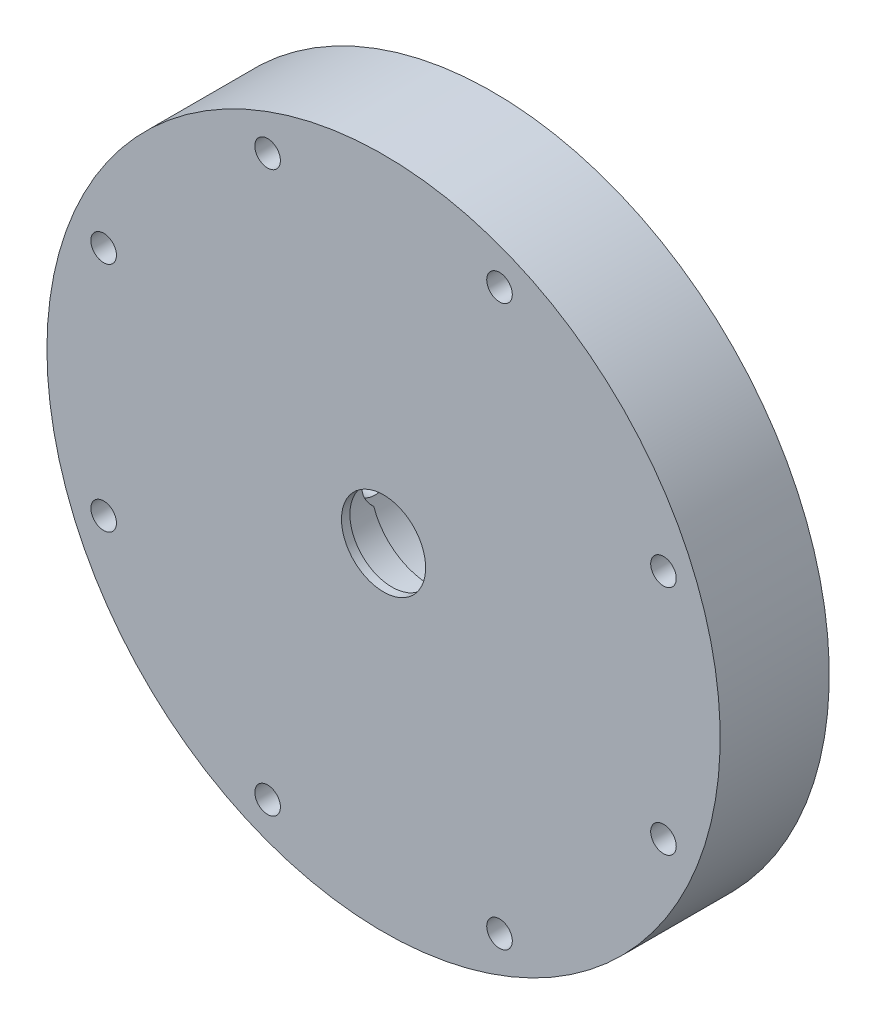
from build123d import *

# Parameters (mm, degrees)
SKETCH4_R                         = 2.413
CUT_EXTRUDE1_DEPTH                = 94.3255592
CIRPATTERN1_COUNT                 = 8
CUT_EXTRUDE7_START                = -4.826
SKETCH18_R                        = 63.5
SKETCH18_R_2                      = 2.413
CUT_EXTRUDE7_DEPTH                = 4.826
SKETCH17_R                        = 33.02
CUT_EXTRUDE6_DEPTH                = 7.112
PIPE_TAP_DRILL_FOR_3_8_TAP1_D     = 14.2748
PIPE_TAP_DRILL_FOR_3_8_TAP1_DEPTH = 12.7
PIPE_TAP_DRILL_FOR_3_8_TAP1_TIP   = 4.288582582
F_3_8_0_375_DIAMETER_HOLE1_D      = 9.525
F_3_8_0_375_DIAMETER_HOLE1_DEPTH  = 63.5
F_3_8_0_375_DIAMETER_HOLE1_TIP    = 2.861598698
SKETCH19_R                        = 50.8
SKETCH19_R_2                      = 46.0248
SEAL_GROOVE_DEPTH                 = 3.1369


with BuildPart() as part:
    # Sketch16 → Revolve1 (revolve)
    with BuildSketch(Plane(origin=(0, 0, 0), x_dir=(1, 0, 0), z_dir=(0, 1, 0)), mode=Mode.PRIVATE) as revolve1_sk:
        Polygon((7.9375, -25.4), (63.5, -25.4), (63.5, 0), (14.2875, 0), (14.2875, -16.66875), (11.176, -16.66875), (11.176, -23.8125), (7.9375, -23.8125), align=None)
    revolve(revolve1_sk.sketch.rotate(Axis((0, 0, 0), (0, 0, 1)), 180), axis=Axis((0, 0, 0), (0, 0, 1)))

    # Sketch4 → Cut-Extrude1 (cut, through all)
    with BuildSketch(Plane.XY.offset(25.4)):
        with Locations((52.799715283, -21.87035816)):
            Circle(SKETCH4_R)
    cut_extrude1 = extrude(amount=-CUT_EXTRUDE1_DEPTH, mode=Mode.SUBTRACT)

    # CirPattern1: Cut-Extrude1 ×8 about axis
    cirpattern1_axis = Axis((0, 0, 0), (0, 0, 1))
    for i in range(1, CIRPATTERN1_COUNT):
        add(cut_extrude1.rotate(cirpattern1_axis, i * 360 / CIRPATTERN1_COUNT), mode=Mode.SUBTRACT)

    # Sketch18 → Cut-Extrude7 (cut)
    with BuildSketch(Plane(origin=(0, 0, 0), x_dir=(-1, 0, 0), z_dir=(0, 0, -1)).offset(CUT_EXTRUDE7_START)):
        Circle(SKETCH18_R)
        with Locations(Location((-21.87035816, -52.799715283, 0), (0, 0, 225))):
            Circle(SKETCH18_R_2, mode=Mode.SUBTRACT)
        with Locations(Location((-52.799715283, -21.87035816, 0), (0, 0, 180))):
            Circle(SKETCH18_R_2, mode=Mode.SUBTRACT)
        with Locations(Location((21.87035816, -52.799715283, 0), (0, 0, 270))):
            Circle(SKETCH18_R_2, mode=Mode.SUBTRACT)
        with Locations(Location((52.799715283, -21.87035816, 0), (0, 0, 315))):
            Circle(SKETCH18_R_2, mode=Mode.SUBTRACT)
        with Locations((-52.799715283, 21.87035816)):
            Circle(SKETCH18_R_2, mode=Mode.SUBTRACT)
        with BuildLine():
            Line((-38.437855153, -3.307865299), (-41.774591166, -3.307865299))
            ThreePointArc((-41.774591166, -3.307865299), (-44.06614875, -2.330452348), (-44.946809919, 0))
            add(Edge.make_bspline(
                [(-33.928933872, -7.134607515), (-33.928385732, -7.137933992), (-33.833010931, -7.716207568), (-33.613407498, -8.8658869), (-33.198558281, -10.568668335), (-32.697590483, -12.252202478), (-32.111368753, -13.912132646), (-31.440982434, -15.544140087), (-30.6877424, -17.143955629), (-29.853178348, -18.707371069), (-28.939035433, -20.230250424), (-27.947270591, -21.708540989), (-26.880048317, -23.138284208), (-25.739735978, -24.515626324), (-24.52889861, -25.836828804), (-23.250293206, -27.098278486), (-21.906862513, -28.296497465), (-20.501728328, -29.428152646), (-19.038184319, -30.490064988), (-17.519688378, -31.479218369), (-15.949854523, -32.392768086), (-14.332444364, -33.228048947), (-12.67135816, -33.982582934), (-10.970625473, -34.654086422), (-9.23439546, -35.240476937), (-7.466926803, -35.739879413), (-5.672577322, -36.150631964), (-3.855793286, -36.471291116), (-2.021098439, -36.700636517), (-0.173082793, -36.837675086), (1.683608814, -36.881644605), (3.544288344, -36.832016725), (5.404236353, -36.688499397), (7.258713917, -36.451038699), (9.102974666, -36.119820063), (10.932276886, -35.695268896), (12.741895669, -35.178050585), (14.527135072, -34.569069886), (16.283340262, -33.869469699), (18.005909603, -33.080629222), (19.690306669, -32.204161496), (21.332072136, -31.241910334), (22.926835541, -30.195946649), (24.470326852, -29.068564177), (25.958387849, -27.862274615), (27.386983251, -26.579802172), (28.752211598, -25.224077558), (30.05031582, -23.798231409), (31.277693495, -22.305587173), (32.430906752, -20.749653473), (33.506691795, -19.134115953), (34.501968029, -17.462828639), (35.41384675, -15.739804832), (36.239639383, -13.969207544), (36.976865247, -12.155339516), (37.623258819, -10.302632827), (38.176776478, -8.415638129), (38.635602708, -6.499013531), (38.99815575, -4.557513153), (39.263092672, -2.595975388), (39.429313851, -0.619310898), (39.495966855, 1.367509636), (39.462449705, 3.359467962), (39.328413504, 5.351510889), (39.09376444, 7.338563062), (38.758665131, 9.315539846), (38.323535331, 11.277360294), (37.789051968, 13.218960162), (37.15614853, 15.135304935), (36.426013787, 17.021402835), (35.600089858, 18.872317778), (34.680069611, 20.683182241), (33.667893419, 22.449210007), (32.565745258, 24.165708766), (31.376048171, 25.828092515), (30.101459097, 27.431893755), (28.744863072, 28.972775422), (27.309366835, 30.446542545), (25.798291819, 31.849153584), (24.215166578, 33.176731426), (22.563718643, 34.425574005), (20.847865831, 35.59216452), (19.071707037, 36.673181218), (17.239512511, 37.665506723), (15.355713667, 38.566236878), (13.424892429, 39.37268908), (11.451770141, 40.082410076), (9.441196087, 40.693183217), (7.398135616, 41.203035118), (5.327657937, 41.610241741), (3.234923583, 41.913333848), (1.125171597, 42.11110184), (-0.996293545, 42.202599933), (-3.124115223, 42.187149688), (-5.252898166, 42.06434287), (-7.377222085, 41.834043617), (-9.491655438, 41.49638993), (-11.590769276, 41.051794458), (-13.669151145, 40.500944594), (-15.721418994, 39.844801852), (-17.742235078, 39.084600556), (-19.726319787, 38.221845804), (-21.668465399, 37.258310751), (-23.563549696, 36.196033176), (-25.406549423, 35.037311368), (-27.192553543, 33.784699317), (-28.916776264, 32.441001244), (-30.574569796, 31.009265451), (-32.161436808, 29.492777532), (-33.673042551, 27.895052942), (-35.10522661, 26.219828948), (-36.454014261, 24.471055979), (-37.715627401, 22.652888394), (-38.88649501, 20.769674689), (-39.963263134, 18.825947167), (-40.942804349, 16.826411093), (-41.822226678, 14.775933368), (-42.59888195, 12.679530733), (-43.27037356, 10.54235755), (-43.834563622, 8.369693173), (-44.289579482, 6.166928958), (-44.619434592, 4.032631678), (-44.788721316, 2.443473873), (-44.861866668, 1.505376084), (-44.887603288, 1.129504244), (-44.905146434, 0.847378207), (-44.920882878, 0.565074904), (-44.934972992, 0.282611952), (-44.942863945, 0.09421189), (-44.946809919, 0)],
                knots=[0.028816302, 0.028816302, 0.028816302, 0.028816302, 0.028857006, 0.035892384, 0.042943403, 0.050010121, 0.057092589, 0.064190856, 0.07130497, 0.078434976, 0.085580915, 0.092742831, 0.099920762, 0.107114747, 0.114324823, 0.121551027, 0.128793394, 0.136051958, 0.143326753, 0.150617811, 0.157925165, 0.165248846, 0.172588885, 0.179945312, 0.187318157, 0.194707448, 0.202113215, 0.209535486, 0.216974287, 0.224429648, 0.231901594, 0.239390153, 0.246895349, 0.25441721, 0.261955761, 0.269511026, 0.277083032, 0.284671801, 0.29227736, 0.299899731, 0.307538938, 0.315195006, 0.322867957, 0.330557814, 0.338264601, 0.345988339, 0.353729051, 0.36148676, 0.369261487, 0.377053255, 0.384862084, 0.392687996, 0.400531013, 0.408391155, 0.416268443, 0.424162899, 0.432074542, 0.440003393, 0.447949473, 0.455912802, 0.463893399, 0.471891284, 0.479906477, 0.487938998, 0.495988866, 0.5040561, 0.51214072, 0.520242745, 0.528362193, 0.536499083, 0.544653435, 0.552825266, 0.561014596, 0.569221442, 0.577445824, 0.585687758, 0.593947263, 0.602224358, 0.61051906, 0.618831386, 0.627161355, 0.635508984, 0.643874291, 0.652257292, 0.660658007, 0.66907645, 0.677512641, 0.685966595, 0.69443833, 0.702927863, 0.711435211, 0.71996039, 0.728503417, 0.737064309, 0.745643082, 0.754239753, 0.762854337, 0.771486853, 0.780137315, 0.788805739, 0.797492143, 0.806196542, 0.814918952, 0.823659389, 0.832417868, 0.841194407, 0.849989019, 0.858801722, 0.86763253, 0.87648146, 0.885348526, 0.894233744, 0.90313713, 0.912058699, 0.920998466, 0.929956446, 0.938932655, 0.947927107, 0.956939818, 0.965970803, 0.975020076, 0.984087653, 0.992036809, 0.994310574, 0.995447886, 0.996585485, 0.99772337, 0.998861542, 1, 1, 1, 1], degree=3))
            ThreePointArc((-33.928933872, -7.134607515), (-35.480900338, -4.393511216), (-38.437855153, -3.307865299))
        make_face(mode=Mode.SUBTRACT)
        with Locations((-21.87035816, 52.799715283)):
            Circle(SKETCH18_R_2, mode=Mode.SUBTRACT)
        with Locations((52.799715283, 21.87035816)):
            Circle(SKETCH18_R_2, mode=Mode.SUBTRACT)
        with Locations(Location((21.87035816, 52.799715283, 0), (0, 0, 45))):
            Circle(SKETCH18_R_2, mode=Mode.SUBTRACT)
    extrude(amount=CUT_EXTRUDE7_DEPTH, mode=Mode.SUBTRACT)

    # Sketch17 → Cut-Extrude6 (cut)
    with BuildSketch(Plane(origin=(0, 0, 0), x_dir=(-1, 0, 0), z_dir=(0, 0, -1))):
        Circle(SKETCH17_R)
    extrude(amount=-CUT_EXTRUDE6_DEPTH, mode=Mode.SUBTRACT)

    # Pipe Tap Drill for 3/8 Tap1
    with Locations(Plane(origin=(-63.5, 0, 13.55725), x_dir=(0, 0, -1), z_dir=(-1, 0, 0))):
        with Locations((0, 0)):
            Hole(PIPE_TAP_DRILL_FOR_3_8_TAP1_D / 2, depth=PIPE_TAP_DRILL_FOR_3_8_TAP1_DEPTH)
            with Locations((0, 0, -(PIPE_TAP_DRILL_FOR_3_8_TAP1_DEPTH + PIPE_TAP_DRILL_FOR_3_8_TAP1_TIP / 2))):  # 118° drill point
                Cone(0, PIPE_TAP_DRILL_FOR_3_8_TAP1_D / 2, PIPE_TAP_DRILL_FOR_3_8_TAP1_TIP, mode=Mode.SUBTRACT)

    # 3/8 (0.375) Diameter Hole1
    with Locations(Plane.ZY.offset(63.5)):
        with Locations((13.55725, 0)):
            Hole(F_3_8_0_375_DIAMETER_HOLE1_D / 2, depth=F_3_8_0_375_DIAMETER_HOLE1_DEPTH)
            with Locations((0, 0, -(F_3_8_0_375_DIAMETER_HOLE1_DEPTH + F_3_8_0_375_DIAMETER_HOLE1_TIP / 2))):  # 118° drill point
                Cone(0, F_3_8_0_375_DIAMETER_HOLE1_D / 2, F_3_8_0_375_DIAMETER_HOLE1_TIP, mode=Mode.SUBTRACT)

    # Sketch19 → Seal Groove (cut)
    with BuildSketch(Plane(origin=(0, 0, 4.826), x_dir=(-1, 0, 0), z_dir=(0, 0, -1))):
        Circle(SKETCH19_R)
        Circle(SKETCH19_R_2, mode=Mode.SUBTRACT)
    extrude(amount=-SEAL_GROOVE_DEPTH, mode=Mode.SUBTRACT)


solid = part.part
